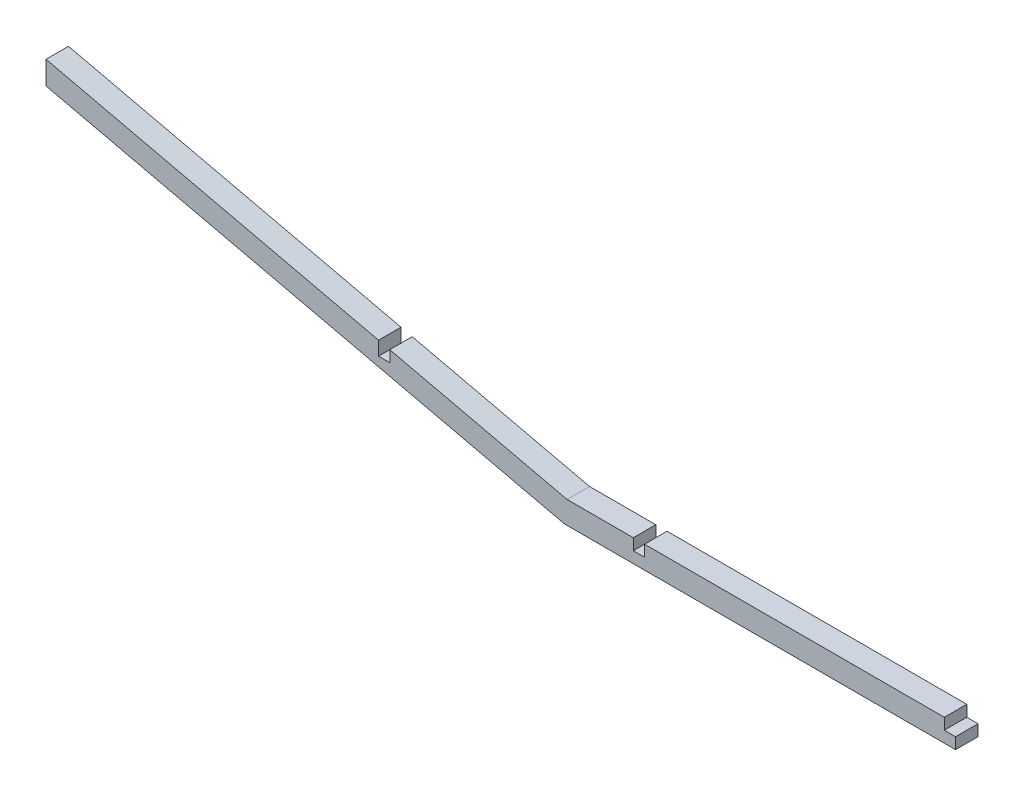
from build123d import *

# Parameters (mm, degrees)
BOSS_EXTRUDE1_DEPTH = 6


with BuildPart() as part:
    # Sketch1 → Boss-Extrude1 (new body)
    with BuildSketch(Plane.XY):
        Polygon((0, 0), (0, 3), (-3, 3), (-3, 6), (-83, 6), (-83, 3), (-86, 3), (-86, 6), (-103.676546106, 6), (-151, 16.96), (-151, 13.96), (-154, 13.96), (-154, 17.654792905), (-242.75, 38.209083008), (-242.75, 32.05027235), (-104.362264068, 0), align=None)
    extrude(amount=BOSS_EXTRUDE1_DEPTH)


solid = part.part
